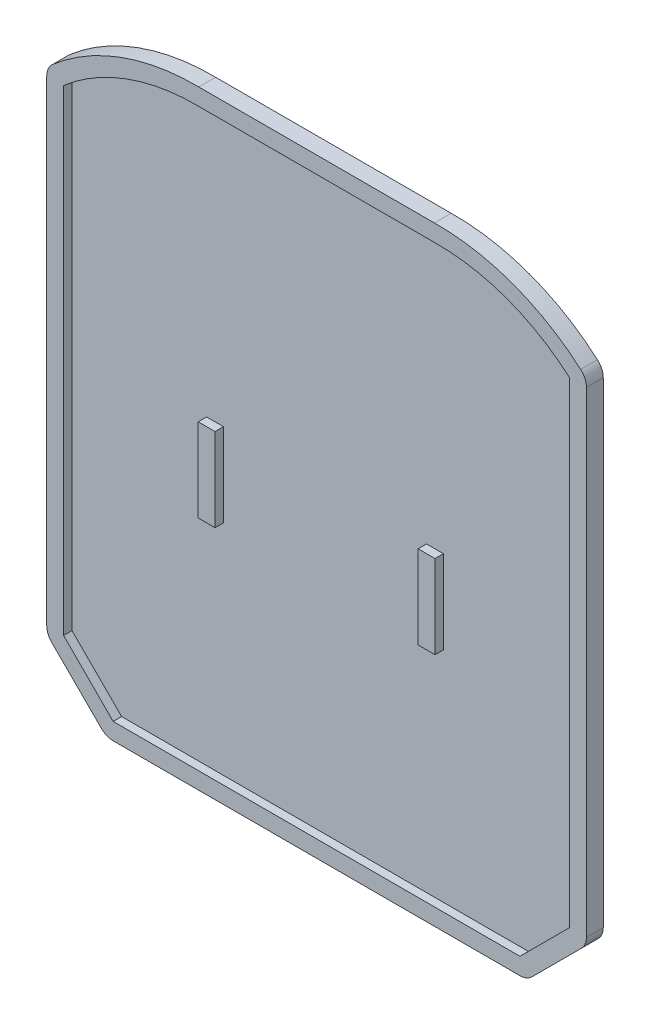
from build123d import *

# Parameters (mm, degrees)
BOSS_EXTRUDE1_DEPTH = 10
CUT_EXTRUDE3_DEPTH  = 5
SKETCH5_W           = 10
SKETCH5_H           = 49.5
BOSS_EXTRUDE2_DEPTH = 5
FILLET1_R           = 10
SKETCH6_W           = 10
SKETCH6_H           = 300
CUT_EXTRUDE5_DEPTH  = 4
SKETCH8_W           = 10
SKETCH8_H           = 30
BOSS_EXTRUDE3_DEPTH = 4
SKETCH10_W          = 10
SKETCH10_H          = 300
CUT_EXTRUDE6_DEPTH  = 4
SKETCH11_W          = 10
SKETCH11_H          = 30
BOSS_EXTRUDE4_DEPTH = 4


with BuildPart() as part:
    # Sketch1 → Boss-Extrude1 (new body)
    with BuildSketch(Plane.XY):
        with BuildLine():
            Line((0, 0), (250, 0))
            Line((250, 0), (285.355339059, 35.355339059))
            Line((285.355339059, 35.355339059), (285.355339059, 326.955339059))
            ThreePointArc((285.355339059, 326.955339059), (243.560486982, 353.188356712), (195, 361.955339059))
            Line((195, 361.955339059), (55, 361.955339059))
            ThreePointArc((55, 361.955339059), (6.439513018, 353.188356712), (-35.355339059, 326.955339059))
            Line((-35.355339059, 326.955339059), (-35.355339059, 35.355339059))
            Line((-35.355339059, 35.355339059), (0, 0))
        make_face()
    extrude(amount=BOSS_EXTRUDE1_DEPTH)

    # Sketch4 → Cut-Extrude3 (cut)
    with BuildSketch(Plane.XY.offset(10)):
        with BuildLine():
            Line((-25.355339059, 39.497474683), (4.142135624, 10))
            Line((4.142135624, 10), (245.857864376, 10))
            Line((245.857864376, 10), (275.355339059, 39.497474683))
            Line((275.355339059, 39.497474683), (275.355339059, 322.508901748))
            ThreePointArc((275.355339059, 322.508901748), (237.921386907, 344.627720124), (195.062911656, 351.955339059))
            Line((195.062911656, 351.955339059), (54.937088344, 351.955339059))
            ThreePointArc((54.937088344, 351.955339059), (12.078613093, 344.627720124), (-25.355339059, 322.508901748))
            Line((-25.355339059, 322.508901748), (-25.355339059, 39.497474683))
        make_face()
    extrude(amount=-CUT_EXTRUDE3_DEPTH, mode=Mode.SUBTRACT)

    # Sketch5 → Boss-Extrude2 (add)
    with BuildSketch(Plane.XY.offset(5)):
        with Locations((59.644660941, 164.705339059)):
            Rectangle(SKETCH5_W, SKETCH5_H)
        with Locations((190.355339059, 164.705339059)):
            Rectangle(SKETCH5_W, SKETCH5_H)
    extrude(amount=BOSS_EXTRUDE2_DEPTH)

    # Fillet1
    fillet1_edges = [part.edges().sort_by_distance(p)[0] for p in [
        (-35.355339059, 35.355339059, 5),
        (-35.355339059, 326.955339059, 5),
        (285.355339059, 326.955339059, 5),
        (285.355339059, 35.355339059, 5),
        (250, 0, 5),
        (0, 0, 5),
    ]]
    fillet(fillet1_edges, radius=FILLET1_R)

    # Sketch6 → Cut-Extrude5 (cut)
    with BuildSketch(Plane(origin=(0, 0, 0), x_dir=(-1, 0, 0), z_dir=(0, 0, -1))):
        with Locations((-230.355339059, 180)):
            Rectangle(SKETCH6_W, SKETCH6_H)
    extrude(amount=-CUT_EXTRUDE5_DEPTH, mode=Mode.SUBTRACT)

    # Sketch8 → Boss-Extrude3 (add)
    with BuildSketch(Plane(origin=(0, 0, 4), x_dir=(-1, 0, 0), z_dir=(0, 0, -1))):
        with Locations((-230.355339059, 285)):
            Rectangle(SKETCH8_W, SKETCH8_H)
        with Locations((-230.355339059, 75)):
            Rectangle(SKETCH8_W, SKETCH8_H)
    extrude(amount=BOSS_EXTRUDE3_DEPTH)

    # Sketch10 → Cut-Extrude6 (cut)
    with BuildSketch(Plane(origin=(0, 0, 0), x_dir=(-1, 0, 0), z_dir=(0, 0, -1))):
        with Locations((-19.644660941, 180)):
            Rectangle(SKETCH10_W, SKETCH10_H)
    extrude(amount=-CUT_EXTRUDE6_DEPTH, mode=Mode.SUBTRACT)

    # Sketch11 → Boss-Extrude4 (add)
    with BuildSketch(Plane(origin=(0, 0, 4), x_dir=(-1, 0, 0), z_dir=(0, 0, -1))):
        with Locations((-19.644660941, 75)):
            Rectangle(SKETCH11_W, SKETCH11_H)
        with Locations((-19.644660941, 285)):
            Rectangle(SKETCH11_W, SKETCH11_H)
    extrude(amount=BOSS_EXTRUDE4_DEPTH)


solid = part.part
